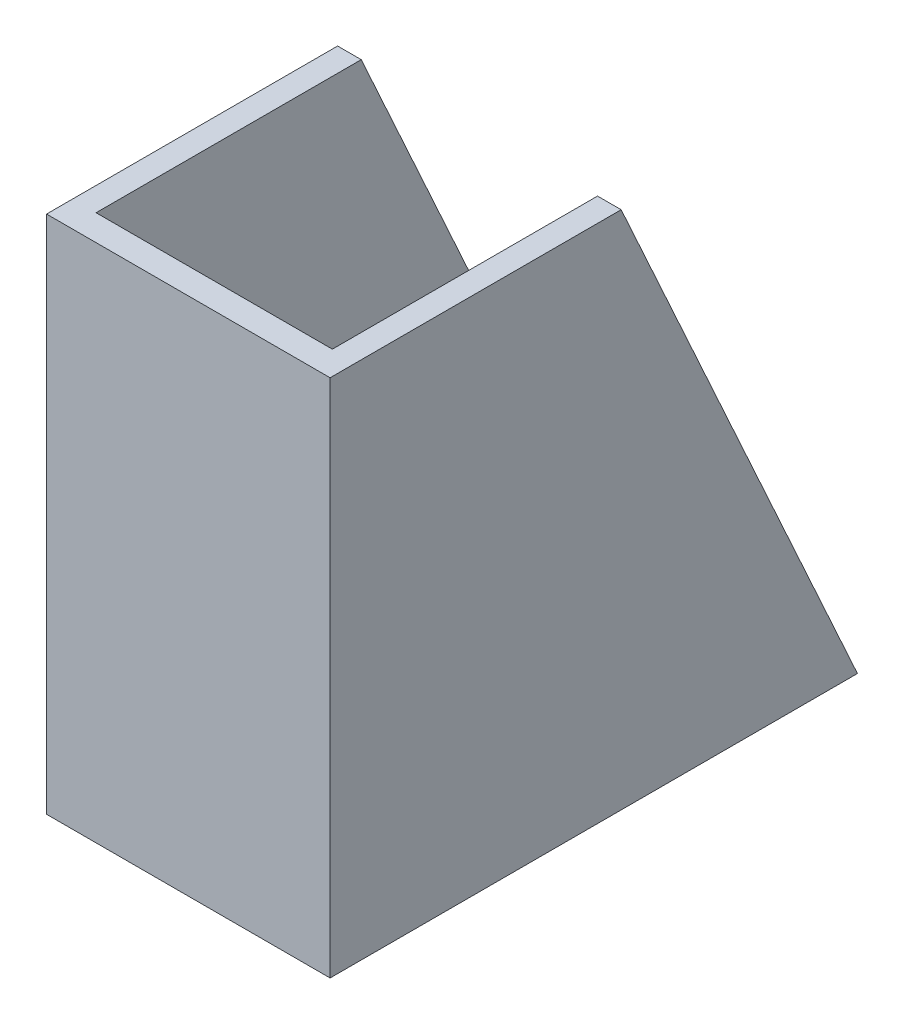
from build123d import *

# Parameters (mm, degrees)
BOSS_EXTRUDE1_DEPTH     = 60
CUT_EXTRUDE1_DEPTH      = 25
CUT_EXTRUDE1_DEPTH_BACK = 25


with BuildPart() as part:
    # Sketch1 → Boss-Extrude1 (new body)
    with BuildSketch(Plane(origin=(0, 0, 0), x_dir=(0, 0, -1), z_dir=(1, 0, 0))):
        Polygon((30.795, 76.26991563), (80.795, -33.73008437), (-30.795, -33.73008437), (-30.795, 76.26991563), align=None)
    extrude(amount=-BOSS_EXTRUDE1_DEPTH)

    # Sketch2 → Cut-Extrude1 (cut, two sides: drawn at the far end of the back side and taken through both)
    with BuildSketch(Plane(origin=(-30, 0, 0), x_dir=(0, 0, -1), z_dir=(1, 0, 0)).offset(-CUT_EXTRUDE1_DEPTH_BACK)):
        Polygon((30.795, 76.26991563), (-25.315, 76.26991563), (-25.315, 71.26991563), (-25.795, 71.26991563), (-25.795, -28.73008437), (78.522272727, -28.73008437), align=None)
    extrude(amount=CUT_EXTRUDE1_DEPTH + CUT_EXTRUDE1_DEPTH_BACK, mode=Mode.SUBTRACT)


solid = part.part
